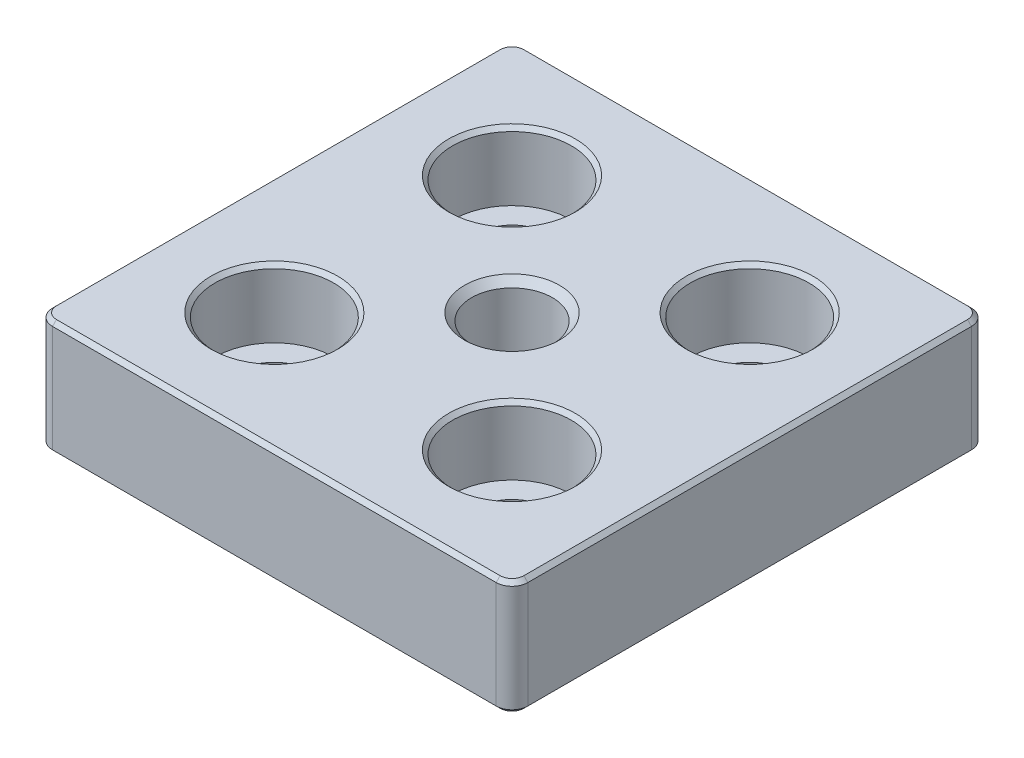
from build123d import *

# Parameters (mm, degrees)
SKETCH1_W                                    = 60
SKETCH1_H                                    = 60
BOSS_EXTRUDE1_DEPTH                          = 14.5
CBORE_FOR_M8_HEX_SOCKET_HEAD_CAP_SCR_2_COUNT = 2
CBORE_FOR_M8_HEX_SOCKET_HEAD_CAP_SCR_2_PITCH = 30
CBORE_FOR_M8_HEX_SOCKET_HEAD_CAP_SCR_3_COUNT = 2
CBORE_FOR_M8_HEX_SOCKET_HEAD_CAP_SCR_3_PITCH = 42.426406871
CBORE_FOR_M8_HEX_SOCKET_HEAD_CAP_SCR_4_COUNT = 2
CBORE_FOR_M8_HEX_SOCKET_HEAD_CAP_SCR_4_PITCH = 30
FILLET1_R                                    = 2
CHAMFER1_SIZE                                = 0.5


with BuildPart() as part:
    # Sketch1 → Boss-Extrude1 (new body)
    with BuildSketch(Plane(origin=(0, 0, 0), x_dir=(1, 0, 0), z_dir=(0, 1, 0))):
        Rectangle(SKETCH1_W, SKETCH1_H)
    extrude(amount=BOSS_EXTRUDE1_DEPTH)

    # Sketch4 → CBORE for M8 Hex Socket Head Cap Screw1 (revolve, cut)
    with BuildSketch(Plane(origin=(-15, 14.5, 15), x_dir=(0, 0, 1), z_dir=(1, 0, 0))):
        Polygon((0, 0), (0, 14.5), (5, 14.5), (4.5, 14), (4.5, 8.6), (7.5, 8.6), (7.5, 0.5), (8, 0), align=None)
    cbore_for_m8_hex_socket_head_cap_screw1 = revolve(axis=Axis((-15, 20.85, 15), (0, -1, 0)), mode=Mode.SUBTRACT)

    # CBORE for M8 Hex Socket Head Cap Scr 2: CBORE for M8 Hex Socket Head Cap Screw1 ×2
    with Locations(*[(i * CBORE_FOR_M8_HEX_SOCKET_HEAD_CAP_SCR_2_PITCH, 0, 0) for i in range(1, CBORE_FOR_M8_HEX_SOCKET_HEAD_CAP_SCR_2_COUNT)]):
        add(cbore_for_m8_hex_socket_head_cap_screw1, mode=Mode.SUBTRACT)

    # CBORE for M8 Hex Socket Head Cap Scr 3: CBORE for M8 Hex Socket Head Cap Screw1 ×2
    with Locations(*[Vector(0.7071067811865476, 0, -0.7071067811865476) * (i * CBORE_FOR_M8_HEX_SOCKET_HEAD_CAP_SCR_3_PITCH) for i in range(1, CBORE_FOR_M8_HEX_SOCKET_HEAD_CAP_SCR_3_COUNT)]):
        add(cbore_for_m8_hex_socket_head_cap_screw1, mode=Mode.SUBTRACT)

    # CBORE for M8 Hex Socket Head Cap Scr 4: CBORE for M8 Hex Socket Head Cap Screw1 ×2
    with Locations(*[(0, 0, -i * CBORE_FOR_M8_HEX_SOCKET_HEAD_CAP_SCR_4_PITCH) for i in range(1, CBORE_FOR_M8_HEX_SOCKET_HEAD_CAP_SCR_4_COUNT)]):
        add(cbore_for_m8_hex_socket_head_cap_screw1, mode=Mode.SUBTRACT)

    # Sketch7 → M12 Tapped Hole1 (revolve, cut)
    with BuildSketch(Plane(origin=(0, 14.5, 0), x_dir=(0, 0, 1), z_dir=(1, 0, 0))):
        Polygon((0, 0), (0, 14.5), (6, 14.5), (5.1, 13.6), (5.1, 0.9), (6, 0), align=None)
    revolve(axis=Axis((0, 20.85, 0), (0, -1, 0)), mode=Mode.SUBTRACT)

    # Fillet1
    fillet1_edges = [part.edges().sort_by_distance(p)[0] for p in [
        (-30, 7.25, -30),
        (30, 7.25, -30),
        (30, 7.25, 30),
        (-30, 7.25, 30),
    ]]
    fillet(fillet1_edges, radius=FILLET1_R)

    # Chamfer1
    chamfer1_edges = [part.edges().sort_by_distance(p)[0] for p in [
        (0, 0, 30),
        (0, 14.5, 30),
        (-30, 0, 0),
        (0, 0, -30),
        (30, 0, 0),
        (-29.414213562, 0, -29.414213562),
        (29.414213562, 0, -29.414213562),
        (29.414213562, 0, 29.414213562),
        (-29.414213562, 0, 29.414213562),
        (-30, 14.5, 0),
        (30, 14.5, 0),
        (0, 14.5, -30),
        (-29.414213562, 14.5, -29.414213562),
        (29.414213562, 14.5, -29.414213562),
        (29.414213562, 14.5, 29.414213562),
        (-29.414213562, 14.5, 29.414213562),
    ]]
    chamfer(chamfer1_edges, length=CHAMFER1_SIZE)


solid = part.part
